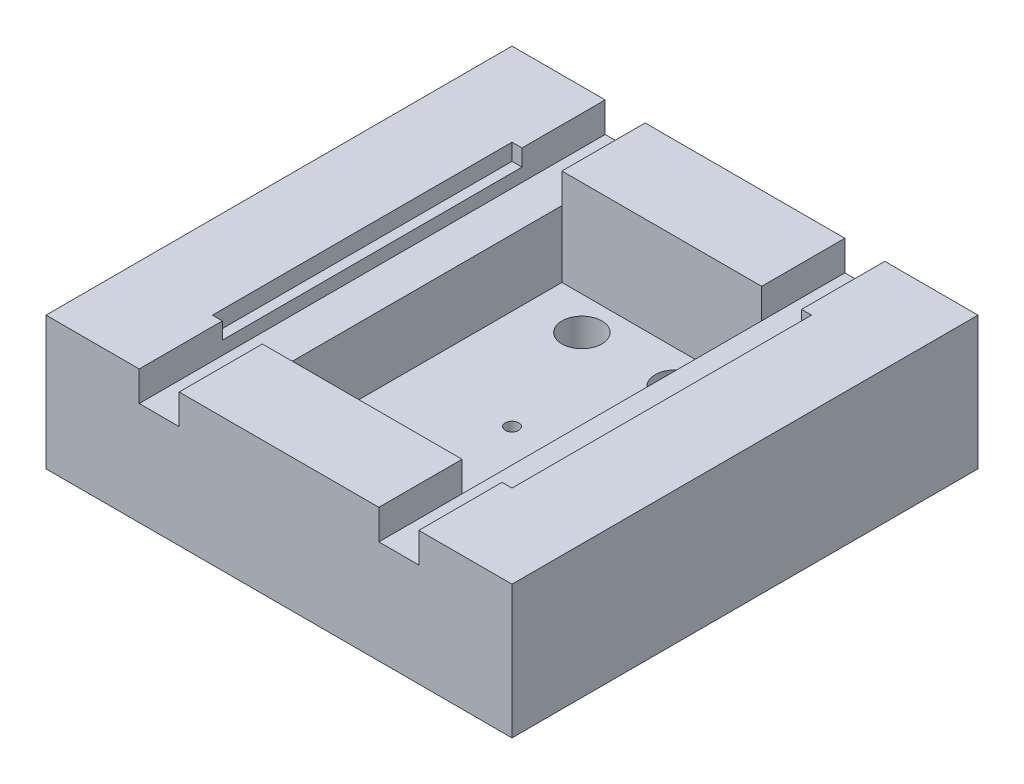
from build123d import *

# Parameters (mm, degrees)
CROQUIS1_W                 = 70
CROQUIS1_H                 = 70
SALIENTE_EXTRUIR1_DEPTH    = 20
CROQUIS2_W                 = 45
CROQUIS2_H                 = 45
CORTAR_EXTRUIR1_DEPTH      = 2.5
CORTAR_EXTRUIR2_DEPTH      = 12.5
CORTAR_EXTRUIR2_DEPTH_BACK = 2
CROQUIS3_W                 = 6
CROQUIS3_H                 = 70
CROQUIS4_W                 = 30
CROQUIS4_H                 = 45
CORTAR_EXTRUIR3_DEPTH      = 12
CROQUIS5_R                 = 3
CROQUIS5_R_2               = 1
CORTAR_EXTRUIR4_DEPTH      = 11


with BuildPart() as part:
    # Croquis1 → Saliente-Extruir1 (new body)
    with BuildSketch(Plane(origin=(0, 0, 0), x_dir=(1, 0, 0), z_dir=(0, 1, 0))):
        with Locations((35, 35)):
            Rectangle(CROQUIS1_W, CROQUIS1_H)
    extrude(amount=SALIENTE_EXTRUIR1_DEPTH)

    # Croquis2 → Cortar-Extruir1 (cut)
    with BuildSketch(Plane(origin=(0, 20, 0), x_dir=(1, 0, 0), z_dir=(0, 1, 0))):
        with Locations((35, 35)):
            Rectangle(CROQUIS2_W, CROQUIS2_H)
    extrude(amount=-CORTAR_EXTRUIR1_DEPTH, mode=Mode.SUBTRACT)

    # Croquis3 → Cortar-Extruir2 (cut, two sides: drawn at the far end of the back side and taken through both)
    with BuildSketch(Plane(origin=(0, 17.5, 0), x_dir=(1, 0, 0), z_dir=(0, 1, 0)).offset(-CORTAR_EXTRUIR2_DEPTH_BACK)):
        with Locations((53, 35)):
            Rectangle(CROQUIS3_W, CROQUIS3_H)
        with Locations((17, 35)):
            Rectangle(CROQUIS3_W, CROQUIS3_H)
    extrude(amount=CORTAR_EXTRUIR2_DEPTH + CORTAR_EXTRUIR2_DEPTH_BACK, mode=Mode.SUBTRACT)

    # Croquis4 → Cortar-Extruir3 (cut)
    with BuildSketch(Plane(origin=(0, 17.5, 0), x_dir=(1, 0, 0), z_dir=(0, 1, 0))):
        with Locations((35, 35)):
            Rectangle(CROQUIS4_W, CROQUIS4_H)
    extrude(amount=-CORTAR_EXTRUIR3_DEPTH, mode=Mode.SUBTRACT)

    # Croquis5 → Cortar-Extruir4 (cut)
    with BuildSketch(Plane(origin=(0, 5.5, 0), x_dir=(1, 0, 0), z_dir=(0, 1, 0))):
        with Locations(Location((28, 17.5, 0), (0, 0, 270))):
            Circle(CROQUIS5_R)
        with Locations(Location((42, 17.5, 0), (0, 0, 270))):
            Circle(CROQUIS5_R)
        with Locations(Location((42, 52.5, 0), (0, 0, 90))):
            Circle(CROQUIS5_R)
        with Locations(Location((28, 52.5, 0), (0, 0, 90))):
            Circle(CROQUIS5_R)
        with Locations(Location((35, 35, 0), (0, 0, 270))):
            Circle(CROQUIS5_R_2)
    extrude(amount=-CORTAR_EXTRUIR4_DEPTH, mode=Mode.SUBTRACT)


solid = part.part
